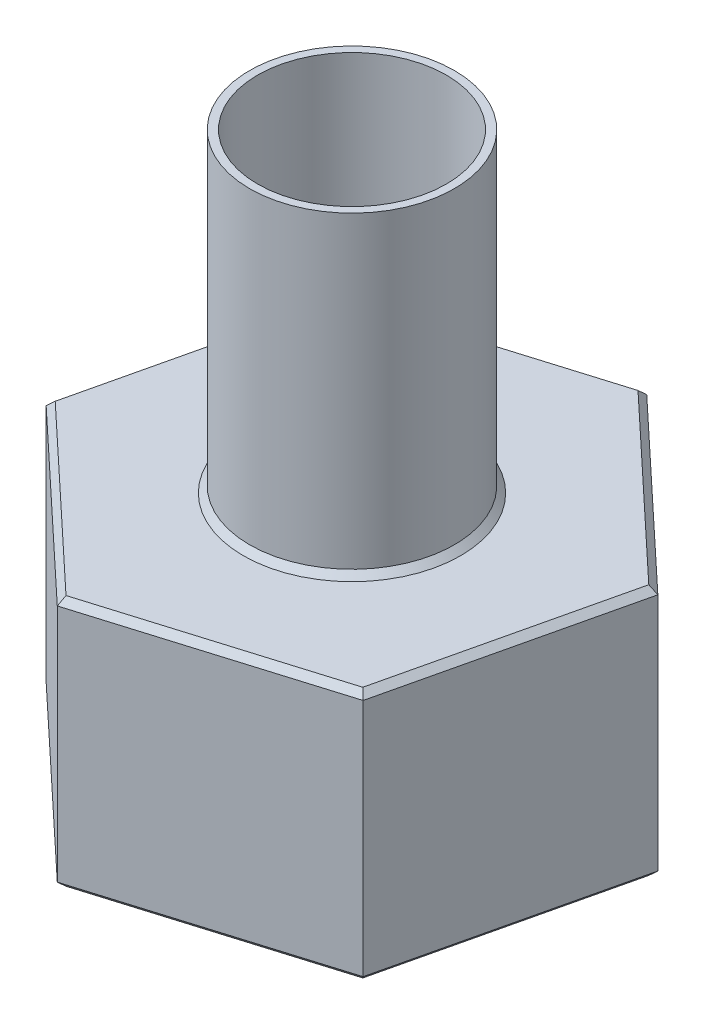
from build123d import *

# Parameters (mm, degrees)
SKETCH_1_R          = 3.253
EXTRUDE_1_DEPTH     = 10
SKETCH_2_R          = 3
CUT_EXTRUDE_1_DEPTH = 10
EXTRUDE_2_DEPTH     = 8
CHAMFER_2_SIZE      = 0.2
SKETCH_6_R          = 6.35
CUT_EXTRUDE_3_DEPTH = 7.5
SCALE_1_SCALE       = 1.703703703


with BuildPart() as part:
    # 草图1 → 凸台-拉伸1 (new body)
    with BuildSketch(Plane(origin=(0, 0, 0), x_dir=(1, 0, 0), z_dir=(0, 1, 0))):
        with Locations(Location((0, 0, 0), (0, 0, 270))):
            Circle(SKETCH_1_R)
    extrude(amount=EXTRUDE_1_DEPTH)

    # 草图2 → 切除-拉伸1 (cut)
    with BuildSketch(Plane.XZ):
        with Locations(Location((0, 0, 0), (0, 0, 270))):
            Circle(SKETCH_2_R)
    extrude(amount=-CUT_EXTRUDE_1_DEPTH, mode=Mode.SUBTRACT)

    # 草图3 → 凸台-拉伸2 (add)
    with BuildSketch(Plane.XZ):
        Polygon((1.774601568, -7.589518382), (7.460016506, -2.257909151), (5.685414937, 5.331609231), (-1.774601568, 7.589518382), (-7.460016506, 2.257909151), (-5.685414937, -5.331609231), align=None)
    extrude(amount=EXTRUDE_2_DEPTH)

    # 倒角2
    chamfer_2_edges = [part.edges().sort_by_distance(p)[0] for p in [
        (0, 0, -3.253),
        (-1.955406684, 0, -6.460563807),
        (4.617309037, 0, -4.923713767),
        (6.572715721, 0, 1.53685004),
        (1.955406684, 0, 6.460563807),
        (-4.617309037, 0, 4.923713767),
        (-6.572715721, 0, -1.53685004),
        (-1.955406684, -8, -6.460563807),
        (4.617309037, -8, -4.923713767),
        (6.572715721, -8, 1.53685004),
        (1.955406684, -8, 6.460563807),
        (-4.617309037, -8, 4.923713767),
        (-6.572715721, -8, -1.53685004),
    ]]
    chamfer(chamfer_2_edges, length=CHAMFER_2_SIZE)

    # 草图6 → 切除-拉伸3 (cut)
    with BuildSketch(Plane.XZ.offset(8)):
        with Locations(Location((0, 0, 0), (0, 0, 270))):
            Circle(SKETCH_6_R)
    extrude(amount=-CUT_EXTRUDE_3_DEPTH, mode=Mode.SUBTRACT)


with BuildPart() as part_1:
    # 缩放比例1: scaled about (0, -2.097517818, 0)
    add(part.part.scale(SCALE_1_SCALE).moved(Location((0, 1.476031056, 0))))


solid = part_1.part
